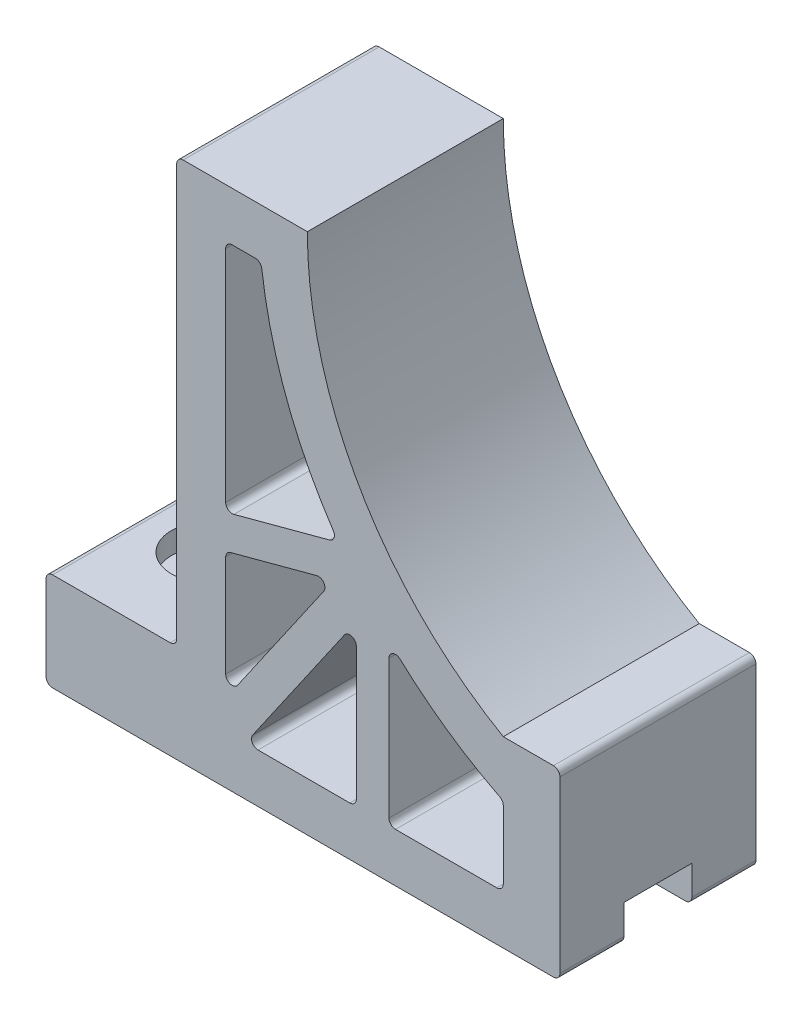
from build123d import *

# Parameters (mm, degrees)
SKETCH1_W                                         = 203.2
SKETCH1_H                                         = 101.6
BOSS_EXTRUDE1_DEPTH                               = 38.1
SKETCH2_R                                         = 76.2
CUT_EXTRUDE1_DEPTH                                = 120.811560377
SKETCH3_W                                         = 38.1
SKETCH3_H                                         = 19.05
BOSS_EXTRUDE2_DEPTH                               = 25.4
CUT_EXTRUDE2_DEPTH                                = 142.990316571
BOSS_EXTRUDE3_DEPTH                               = 38.1
BOSS_EXTRUDE4_DEPTH                               = 38.1
BOSS_EXTRUDE5_DEPTH                               = 38.1
FILLET1_R                                         = 1.27
FILLET2_R                                         = 1.27
SKETCH8_W                                         = 177.8
SKETCH8_H                                         = 152.4
CUT_EXTRUDE4_DEPTH                                = 142.990316571
FILLET3_R                                         = 1.27
CBORE_FOR_5_16_BUTTON_HEAD_CAP_SCREW1_D           = 8.4328
CBORE_FOR_5_16_BUTTON_HEAD_CAP_SCREW1_CBORE_D     = 14.68374
CBORE_FOR_5_16_BUTTON_HEAD_CAP_SCREW1_CBORE_DEPTH = 4.2164
SKETCH11_W                                        = 11.022458007
SKETCH11_H                                        = 35.608864266
BOSS_EXTRUDE6_DEPTH                               = 38.1
FILLET4_R                                         = 1.27
SKETCH15_W                                        = 13.208
SKETCH15_H                                        = 6.985
CUT_EXTRUDE6_DEPTH                                = 19.05
FILLET5_R                                         = 1.27


with BuildPart() as part:
    # Sketch1 → Boss-Extrude1 (new body)
    with BuildSketch(Plane.XY):
        Rectangle(SKETCH1_W, SKETCH1_H)
    extrude(amount=BOSS_EXTRUDE1_DEPTH)

    # Sketch2 → Cut-Extrude1 (cut, through all)
    with BuildSketch(Plane.XY.offset(38.1)):
        with Locations((0, 50.8)):
            Circle(SKETCH2_R)
    extrude(amount=-CUT_EXTRUDE1_DEPTH, mode=Mode.SUBTRACT)

    # Sketch3 → Boss-Extrude2 (add)
    with BuildSketch(Plane.ZY.offset(101.6)):
        with Locations((19.05, -41.275)):
            Rectangle(SKETCH3_W, SKETCH3_H)
    extrude(amount=BOSS_EXTRUDE2_DEPTH)

    # Sketch4 → Cut-Extrude2 (cut, through all)
    with BuildSketch(Plane.XY.offset(38.1)):
        with BuildLine():
            Line((-85.194189943, 41.275), (-92.075, 41.275))
            Line((-92.075, 41.275), (-92.075, -41.275))
            Line((-92.075, -41.275), (-36.602542053, -41.275))
            Line((-36.602542053, -41.275), (-36.602542053, -26.717930443))
            ThreePointArc((-36.602542053, -26.717930443), (-69.745040174, 0.956194004), (-85.194189943, 41.275))
        make_face()
    extrude(amount=-CUT_EXTRUDE2_DEPTH, mode=Mode.SUBTRACT)

    # Sketch5 → Boss-Extrude3 (add)
    with BuildSketch(Plane.XY.offset(38.1)):
        with BuildLine():
            Line((-62.678249532, -3.066814498), (-97.060420113, -12.27948934))
            ThreePointArc((-97.060420113, -12.27948934), (-100.94898508, -10.03442531), (-98.70392105, -6.145860343))
            Line((-98.70392105, -6.145860343), (-64.321750468, 3.066814498))
            ThreePointArc((-64.321750468, 3.066814498), (-60.433185502, 0.821750468), (-62.678249532, -3.066814498))
        make_face()
    extrude(amount=-BOSS_EXTRUDE3_DEPTH)

    # Sketch6 → Boss-Extrude4 (add)
    with BuildSketch(Plane.XY.offset(38.1)):
        with BuildLine():
            Line((-60.889539792, -1.807241683), (-89.464539792, -43.082241683))
            ThreePointArc((-89.464539792, -43.082241683), (-93.882241683, -43.885460208), (-94.685460208, -39.467758317))
            Line((-94.685460208, -39.467758317), (-66.110460208, 1.807241683))
            ThreePointArc((-66.110460208, 1.807241683), (-61.692758317, 2.610460208), (-60.889539792, -1.807241683))
        make_face()
    extrude(amount=-BOSS_EXTRUDE4_DEPTH)

    # Sketch7 → Boss-Extrude5 (add)
    with BuildSketch(Plane.XY.offset(38.1)):
        with BuildLine():
            Line((-60.325, 0), (-60.325, -43.707479127))
            ThreePointArc((-60.325, -43.707479127), (-63.5, -46.882479127), (-66.675, -43.707479127))
            Line((-66.675, -43.707479127), (-66.675, 0))
            ThreePointArc((-66.675, 0), (-63.5, 3.175), (-60.325, 0))
        make_face()
    extrude(amount=-BOSS_EXTRUDE5_DEPTH)

    # Fillet1
    fillet1_edges = [part.edges().sort_by_distance(p)[0] for p in [
        (-60.325, -41.275, 19.05),
        (-66.675, -41.275, 19.05),
        (-101.6, -31.75, 19.05),
        (-127, -31.75, 19.05),
        (-85.194189943, 41.275, 19.05),
        (-36.602542053, -26.717930443, 19.05),
        (-92.075, 41.275, 19.05),
        (-92.075, -4.369646301, 19.05),
        (-92.075, -10.943650047, 19.05),
        (-70.136622156, 1.508724326, 19.05),
        (-101.6, 50.8, 19.05),
    ]]
    fillet(fillet1_edges, radius=FILLET1_R)

    # Fillet2
    fillet2_edges = [part.edges().sort_by_distance(p)[0] for p in [
        (-92.075, -35.697093572, 19.05),
        (-66.675, -10.164017539, 19.05),
        (-60.325, -10.107060346, 19.05),
        (-71.03501409, -5.306002813, 19.05),
        (-88.213372473, -41.275, 19.05),
    ]]
    fillet(fillet2_edges, radius=FILLET2_R)

    # Sketch8 → Cut-Extrude4 (cut, through all)
    with BuildSketch(Plane.XY.offset(38.1)):
        with Locations((61.822457947, 25.4)):
            Rectangle(SKETCH8_W, SKETCH8_H)
    extrude(amount=-CUT_EXTRUDE4_DEPTH, mode=Mode.SUBTRACT)

    # Fillet3
    fillet3_edges = [part.edges().sort_by_distance(p)[0] for p in [
        (-127, -50.8, 19.05),
        (-27.077542053, -20.426727542, 19.05),
        (-27.077542053, -50.8, 19.05),
        (-36.602542053, -41.275, 19.05),
    ]]
    fillet(fillet3_edges, radius=FILLET3_R)

    # CBORE for 5/16 Button Head Cap Screw1 (through all)
    with Locations(Plane(origin=(0, -31.75, 0), x_dir=(1, 0, 0), z_dir=(0, 1, 0))):
        with Locations((-114.3, -19.05)):
            CounterBoreHole(CBORE_FOR_5_16_BUTTON_HEAD_CAP_SCREW1_D / 2, CBORE_FOR_5_16_BUTTON_HEAD_CAP_SCREW1_CBORE_D / 2, CBORE_FOR_5_16_BUTTON_HEAD_CAP_SCREW1_CBORE_DEPTH)

    # Sketch11 → Boss-Extrude6 (add)
    with BuildSketch(Plane.XY.offset(38.1)):
        with Locations((-32.588771057, -32.995567867)):
            Rectangle(SKETCH11_W, SKETCH11_H)
    extrude(amount=-BOSS_EXTRUDE6_DEPTH)

    # Fillet4
    fillet4_edges = [part.edges().sort_by_distance(p)[0] for p in [
        (-27.077542053, -15.191135734, 19.05),
        (-27.077542053, -50.8, 19.05),
    ]]
    fillet(fillet4_edges, radius=FILLET4_R)

    # Sketch15 → Cut-Extrude6 (cut)
    with BuildSketch(Plane(origin=(-27.077542053, 0, 0), x_dir=(0, 0, -1), z_dir=(1, 0, 0))):
        with Locations((-19.05, -47.3075)):
            Rectangle(SKETCH15_W, SKETCH15_H)
    extrude(amount=-CUT_EXTRUDE6_DEPTH, mode=Mode.SUBTRACT)

    # Fillet5
    fillet5_edges = [part.edges().sort_by_distance(p)[0] for p in [
        (-38.10000006, -41.275, 19.05),
        (-38.10000006, -25.993005023, 19.05),
    ]]
    fillet(fillet5_edges, radius=FILLET5_R)


solid = part.part
